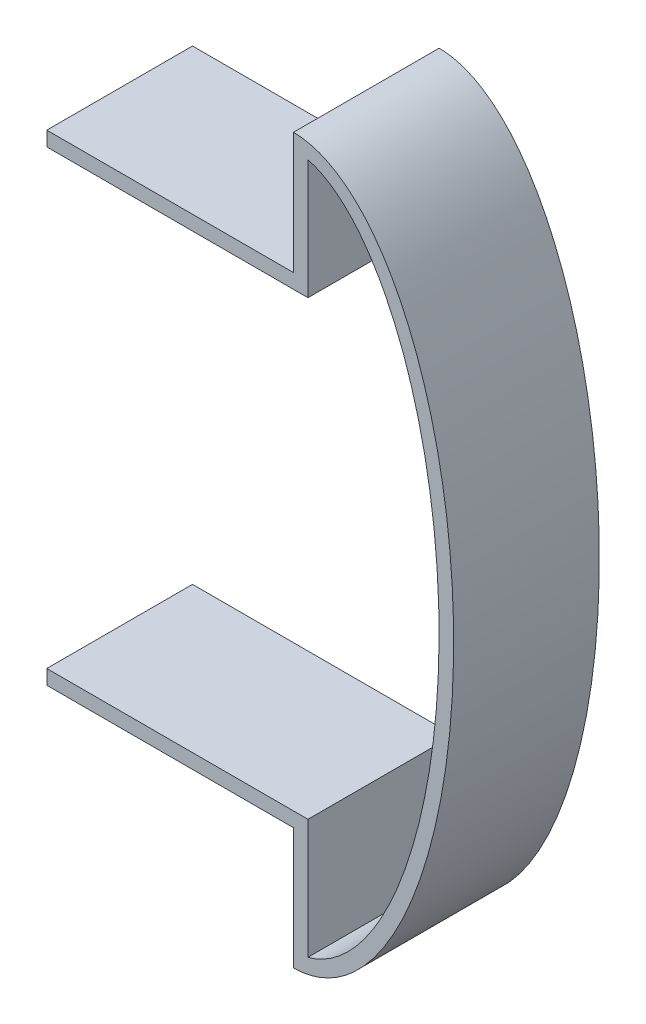
from build123d import *

# Parameters (mm, degrees)
BOSS_EXTRUDE1_DEPTH = 30


with BuildPart() as part:
    # Sketch1 → Boss-Extrude1 (new body)
    with BuildSketch(Plane.XY):
        with BuildLine():
            Line((126.221220655, 121), (180, 121))
            Line((180, 121), (180, 145.612681948))
            add(Edge.make_bspline(
                [(180, 145.612681948), (180.410546957, 145.506670856), (181.209404391, 145.258447166), (182.850309347, 144.577664534), (184.920880242, 143.38514604), (187.428616861, 141.377794933), (190.742052842, 137.929305695), (194.723191139, 132.197775888), (198.959104523, 123.278596787), (202.448319454, 112.648593556), (205.909698128, 96.705429722), (207.726867915, 74.5), (205.909698128, 52.294570278), (202.448319454, 36.351406444), (198.959104523, 25.721403213), (194.723191139, 16.802224112), (190.742052842, 11.070694305), (187.428616861, 7.622205067), (184.920880242, 5.61485396), (182.850309347, 4.422335466), (181.209404391, 3.741552834), (180.410546957, 3.493329144), (180, 3.387318052)],
                knots=[3.255476702, 3.255476702, 3.255476702, 3.255476702, 3.301005211, 3.346533719, 3.437590737, 3.528647754, 3.619704772, 3.801818806, 3.983932841, 4.166046876, 4.348160911, 4.71238898, 5.07661705, 5.258731085, 5.44084512, 5.622959154, 5.805073189, 5.896130207, 5.987187224, 6.078244241, 6.12377275, 6.169301259, 6.169301259, 6.169301259, 6.169301259], degree=3))
            Line((180, 3.387318052), (180, 28))
            Line((180, 28), (126.221220655, 28))
            Line((126.221220655, 28), (126.221220655, 25))
            Line((126.221220655, 25), (177, 25))
            Line((177, 25), (177, 0))
            add(Edge.make_bspline(
                [(177, 0), (210, 0), (210, 74.5), (210, 149), (177, 149)],
                knots=[3.141592654, 3.141592654, 3.141592654, 4.71238898, 4.71238898, 6.283185307, 6.283185307, 6.283185307], degree=2, weights=[1, 0.707106781, 1, 0.707106781, 1]))
            Line((177, 149), (177, 124))
            Line((177, 124), (126.221220655, 124))
            Line((126.221220655, 124), (126.221220655, 121))
        make_face()
    extrude(amount=BOSS_EXTRUDE1_DEPTH)


solid = part.part
